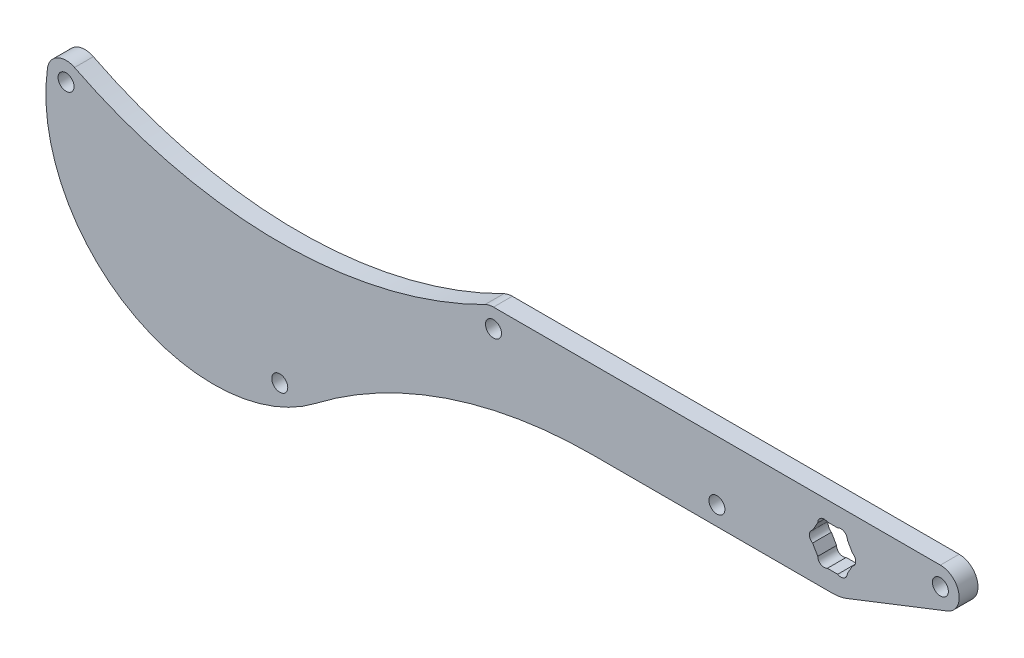
from build123d import *

# Parameters (mm, degrees)
SKETCH4_R           = 2.549999993
SKETCH4_R_2         = 2.55
SKETCH4_R_3         = 6
BOSS_EXTRUDE1_DEPTH = 6
CUT_EXTRUDE1_DEPTH  = 10


with BuildPart() as part:
    # Sketch4 → Boss-Extrude1 (new body)
    with BuildSketch(Plane.XY.offset(19.5)):
        with BuildLine():
            Line((201.961884602, -11.637755102), (233.980730892, 0.913877551))
            ThreePointArc((233.980730892, 0.913877551), (237.686550892, 7.614285714), (231.790928164, 12.5))
            Line((231.790928164, 12.5), (197.399795586, 12.5))
            Line((197.399795586, 12.5), (89.263654418, 12.5))
            ThreePointArc((89.263654418, 12.5), (87.876262264, 12.337391799), (86.564070557, 11.858381004))
            ThreePointArc((86.564070557, 11.858381004), (21.105246497, -3.69943352), (-44.353577564, 11.858381004))
            ThreePointArc((-44.353577564, 11.858381004), (-49.84201029, 11.812468541), (-52.996718657, 7.321052632))
            ThreePointArc((-52.996718657, 7.321052632), (-26.920402355, -46.233558559), (32.526685027, -42.476637828))
            ThreePointArc((32.526685027, -42.476637828), (74.2820165, -20.197808109), (120.978886956, -12.5))
            Line((120.978886956, -12.5), (197.399795586, -12.5))
            ThreePointArc((197.399795586, -12.5), (199.721224158, -12.282547349), (201.961884602, -11.637755102))
        make_face()
        with Locations((160.527291291, -6.5)):
            Circle(SKETCH4_R, mode=Mode.SUBTRACT)
        with Locations((89.263654418, 6.5)):
            Circle(SKETCH4_R, mode=Mode.SUBTRACT)
        with Locations((21.105246497, -42.553713943)):
            Circle(SKETCH4_R, mode=Mode.SUBTRACT)
        with Locations((-47.053161424, 6.5)):
            Circle(SKETCH4_R_2, mode=Mode.SUBTRACT)
        with Locations((197.399795586, 0)):
            Circle(SKETCH4_R_3, mode=Mode.SUBTRACT)
        with Locations((231.790928164, 6.5)):
            Circle(SKETCH4_R, mode=Mode.SUBTRACT)
    extrude(amount=-BOSS_EXTRUDE1_DEPTH)

    # Sketch5 → Cut-Extrude1 (cut)
    with BuildSketch(Plane.XY.offset(19.5)):
        with BuildLine():
            Line((191.03471214, 1.775352078), (192.679753863, 4.624647922))
            ThreePointArc((192.679753863, 4.624647922), (193.704753863, 6.4), (195.754753863, 6.4))
            Line((195.754753863, 6.4), (199.044837309, 6.4))
            ThreePointArc((199.044837309, 6.4), (201.094837309, 6.4), (202.119837309, 4.624647922))
            Line((202.119837309, 4.624647922), (203.764879032, 1.775352078))
            ThreePointArc((203.764879032, 1.775352078), (204.789879032, 0), (203.764879032, -1.775352078))
            Line((203.764879032, -1.775352078), (202.119837309, -4.624647922))
            ThreePointArc((202.119837309, -4.624647922), (201.094837309, -6.4), (199.044837309, -6.4))
            Line((199.044837309, -6.4), (195.754753863, -6.4))
            ThreePointArc((195.754753863, -6.4), (193.704753863, -6.4), (192.679753863, -4.624647922))
            Line((192.679753863, -4.624647922), (191.03471214, -1.775352078))
            ThreePointArc((191.03471214, -1.775352078), (190.00971214, 0), (191.03471214, 1.775352078))
        make_face()
    extrude(amount=-CUT_EXTRUDE1_DEPTH, mode=Mode.SUBTRACT)


solid = part.part
